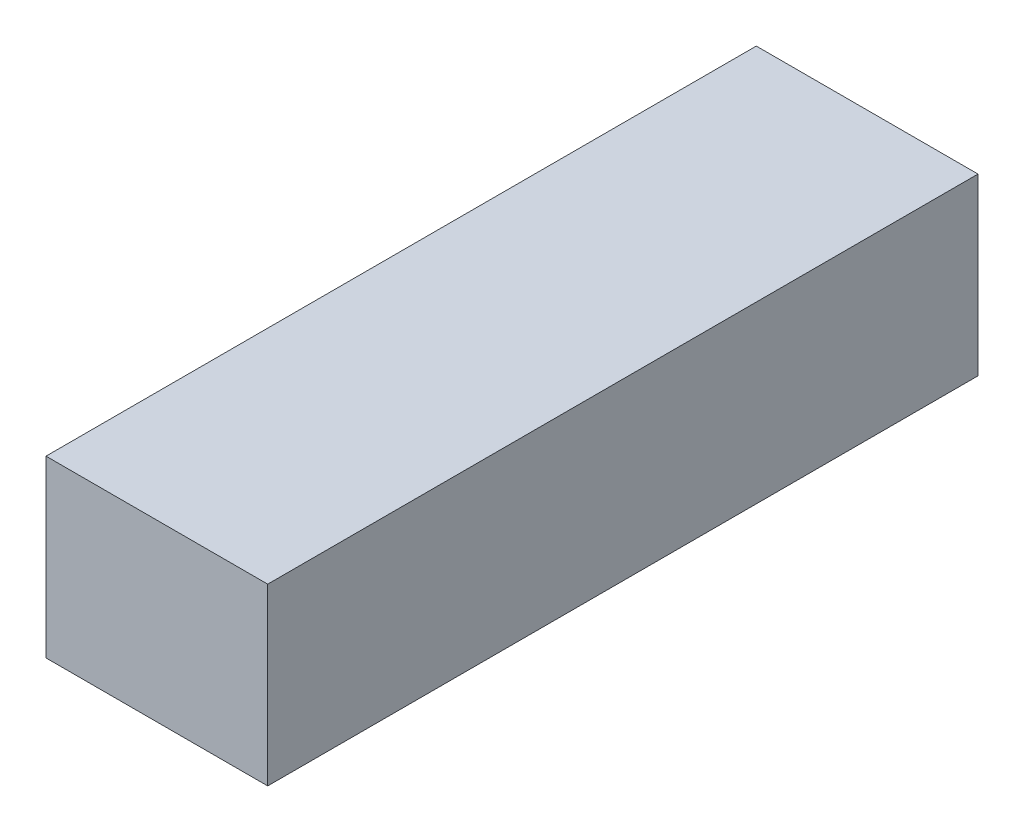
from build123d import *

# Parameters (mm, degrees)
SKETCH1_W           = 31.71177988
SKETCH1_H           = 101.6
BOSS_EXTRUDE1_DEPTH = 25


with BuildPart() as part:
    # Sketch1 → Boss-Extrude1 (new body)
    with BuildSketch(Plane(origin=(0, 0, 0), x_dir=(1, 0, 0), z_dir=(0, 1, 0))):
        with Locations((15.85588994, 50.8)):
            Rectangle(SKETCH1_W, SKETCH1_H)
    extrude(amount=BOSS_EXTRUDE1_DEPTH)


solid = part.part
